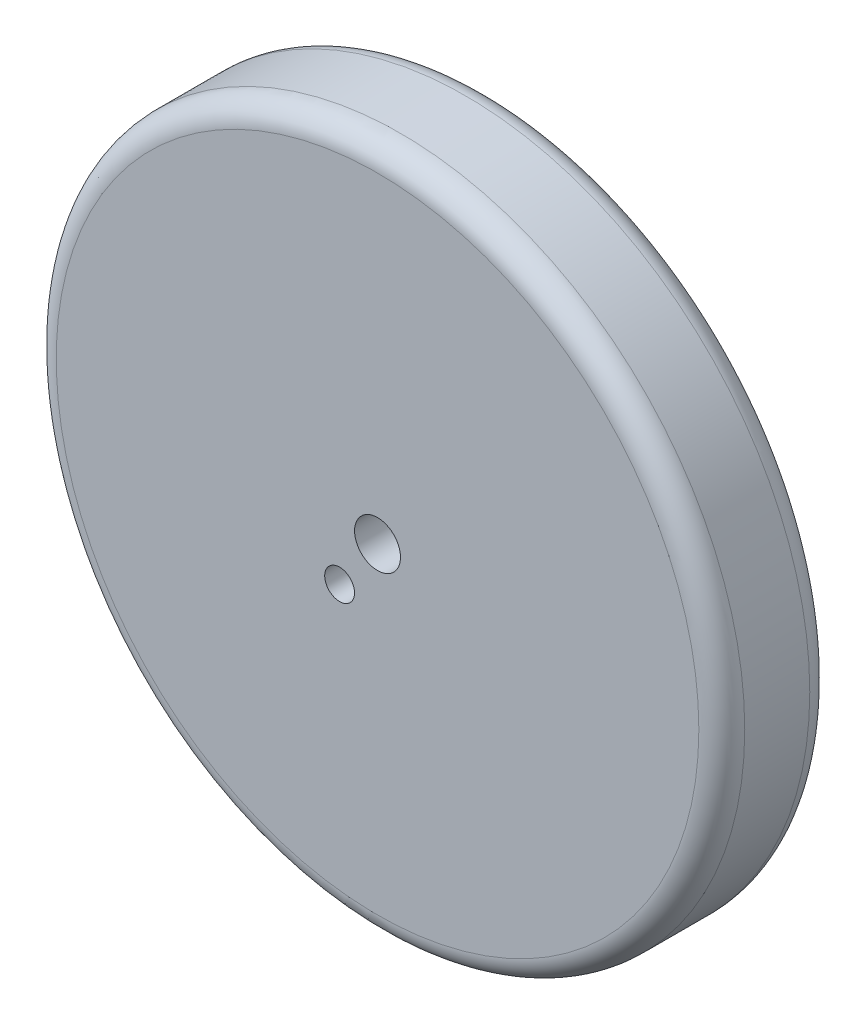
from build123d import *

# Parameters (mm, degrees)
SKETCH1_R           = 45
BOSS_EXTRUDE1_DEPTH = 14.5
FILLET1_R           = 3
SKETCH4_R           = 3
CUT_EXTRUDE1_DEPTH  = 14.5
SKETCH5_R           = 1.95
CUT_EXTRUDE2_DEPTH  = 14.5
CUT_EXTRUDE3_DEPTH  = 1
CIRPATTERN1_COUNT   = 36


with BuildPart() as part:
    # Sketch1 → Boss-Extrude1 (new body)
    with BuildSketch(Plane.XY):
        Circle(SKETCH1_R)
    extrude(amount=BOSS_EXTRUDE1_DEPTH)

    # Fillet1
    fillet1_edges = [part.edges().sort_by_distance(p)[0] for p in [
        (-45, 0, 0),
        (-45, 0, 14.5),
    ]]
    fillet(fillet1_edges, radius=FILLET1_R)

    # Sketch2 → Cut-Revolve1 (revolve, cut)
    with BuildSketch(Plane(origin=(0, 0, 0), x_dir=(1, 0, 0), z_dir=(0, 1, 0))):
        Polygon((0, 3.596621221), (-25, 3.596621221), (-25, 0.069650267), (-10.876704209, -5), (-5, -5), (-5, -2.5), (0, -2.5), align=None)
    revolve(axis=Axis((0, 0, 2.5), (0, 0, -1)), mode=Mode.SUBTRACT)

    # Sketch4 → Cut-Extrude1 (cut)
    with BuildSketch(Plane(origin=(0, 0, 2.5), x_dir=(-1, 0, 0), z_dir=(0, 0, -1))):
        Circle(SKETCH4_R)
    extrude(amount=-CUT_EXTRUDE1_DEPTH, mode=Mode.SUBTRACT)

    # Sketch5 → Cut-Extrude2 (cut)
    with BuildSketch(Plane.XY.offset(14.5)):
        with Locations((-4.955542383, -7.042086544)):
            Circle(SKETCH5_R)
    extrude(amount=-CUT_EXTRUDE2_DEPTH, mode=Mode.SUBTRACT)

    # Sketch6 → Cut-Extrude3 (cut)
    with BuildSketch(Plane(origin=(0, 0, 0), x_dir=(-1, 0, 0), z_dir=(0, 0, -1))):
        with BuildLine():
            Line((-24.711570474, 2.161982274), (-41.84017732, 3.660541195))
            ThreePointArc((-41.84017732, 3.660541195), (-41.960025306, 1.832014269), (-42, 0))
            Line((-42, 0), (-24.805964659, 0))
            ThreePointArc((-24.805964659, 0), (-24.782354877, 1.082020981), (-24.711570474, 2.161982274))
        make_face()
    cut_extrude3 = extrude(amount=-CUT_EXTRUDE3_DEPTH, mode=Mode.SUBTRACT)

    # CirPattern1: Cut-Extrude3 ×36 about axis
    cirpattern1_axis = Axis((0, 0, 14.5), (0, 0, -1))
    for i in range(1, CIRPATTERN1_COUNT):
        add(cut_extrude3.rotate(cirpattern1_axis, i * 360 / CIRPATTERN1_COUNT), mode=Mode.SUBTRACT)


solid = part.part
